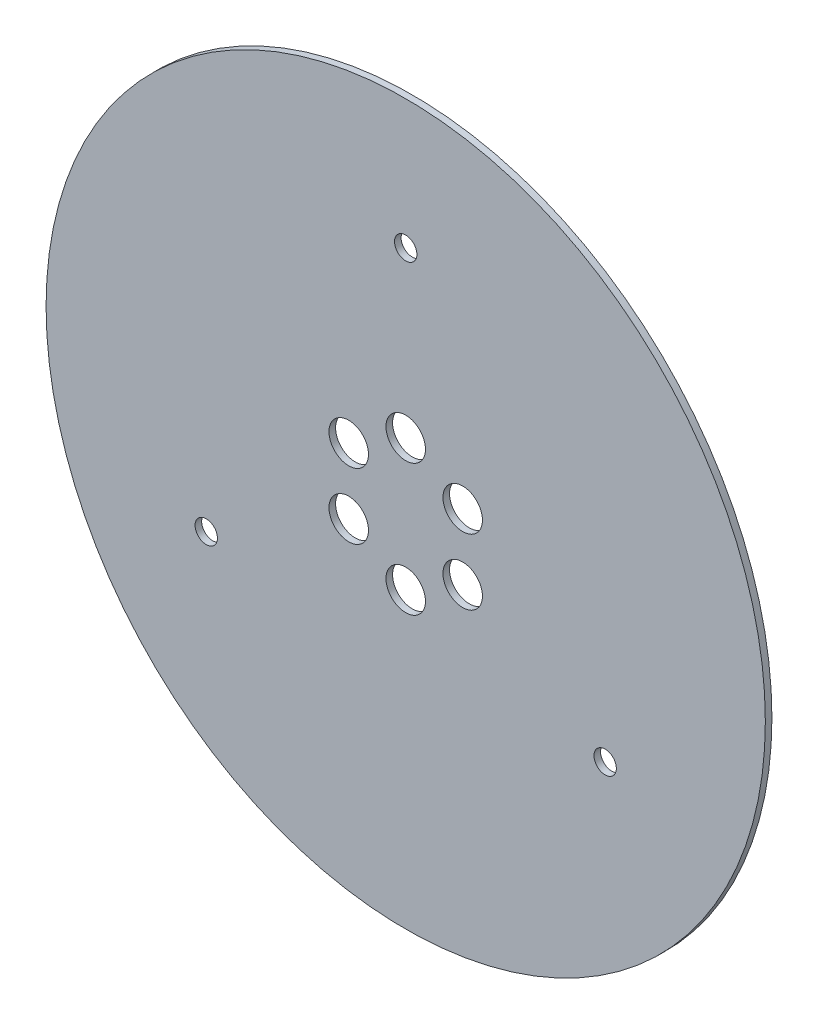
from build123d import *

# Parameters (mm, degrees)
SKETCH1_R           = 54.656342245
SKETCH1_R_2         = 1.7
SKETCH1_R_3         = 3
BOSS_EXTRUDE1_DEPTH = 1


with BuildPart() as part:
    # Sketch1 → Boss-Extrude1 (new body)
    with BuildSketch(Plane.XY):
        Circle(SKETCH1_R)
        with Locations((0, 35)):
            Circle(SKETCH1_R_2, mode=Mode.SUBTRACT)
        with Locations((30.310889132, -17.5)):
            Circle(SKETCH1_R_2, mode=Mode.SUBTRACT)
        with Locations((-30.310889132, -17.5)):
            Circle(SKETCH1_R_2, mode=Mode.SUBTRACT)
        with Locations((0, 10)):
            Circle(SKETCH1_R_3, mode=Mode.SUBTRACT)
        with Locations((8.660254038, 5)):
            Circle(SKETCH1_R_3, mode=Mode.SUBTRACT)
        with Locations((8.660254038, -5)):
            Circle(SKETCH1_R_3, mode=Mode.SUBTRACT)
        with Locations((0, -10)):
            Circle(SKETCH1_R_3, mode=Mode.SUBTRACT)
        with Locations((-8.660254038, -5)):
            Circle(SKETCH1_R_3, mode=Mode.SUBTRACT)
        with Locations((-8.660254038, 5)):
            Circle(SKETCH1_R_3, mode=Mode.SUBTRACT)
    extrude(amount=BOSS_EXTRUDE1_DEPTH)


solid = part.part
